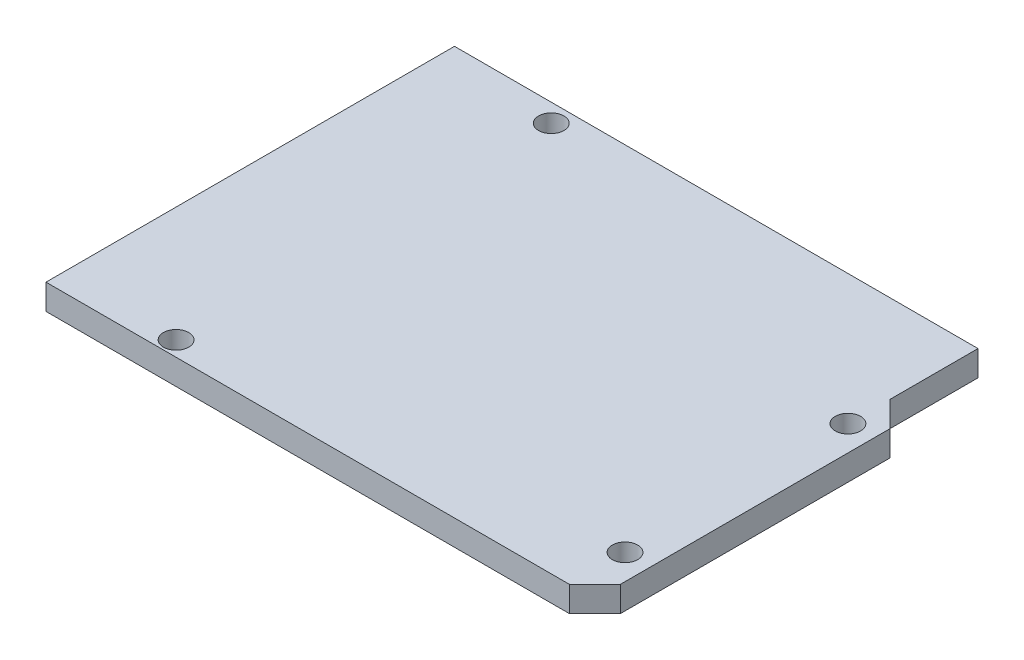
from build123d import *

# Parameters (mm, degrees)
CROQUIS1_R              = 1.6
SALIENTE_EXTRUIR1_DEPTH = 3.2


with BuildPart() as part:
    # Croquis1 → Saliente-Extruir1 (new body)
    with BuildSketch(Plane(origin=(0, 0, 0), x_dir=(1, 0, 0), z_dir=(0, 1, 0))):
        Polygon((0, 0), (66, 0), (69.2, 3.2), (69.2, 37.2), (66, 40.4), (66, 51.5), (0, 51.5), align=None)
        with Locations(Location((14.5, 49.2, 0), (0, 0, 270))):
            Circle(CROQUIS1_R, mode=Mode.SUBTRACT)
        with Locations(Location((14.5, 1.9, 0), (0, 0, 270))):
            Circle(CROQUIS1_R, mode=Mode.SUBTRACT)
        with Locations(Location((66, 35.1, 0), (0, 0, 270))):
            Circle(CROQUIS1_R, mode=Mode.SUBTRACT)
        with Locations(Location((66, 7, 0), (0, 0, 270))):
            Circle(CROQUIS1_R, mode=Mode.SUBTRACT)
    extrude(amount=SALIENTE_EXTRUIR1_DEPTH)


solid = part.part
